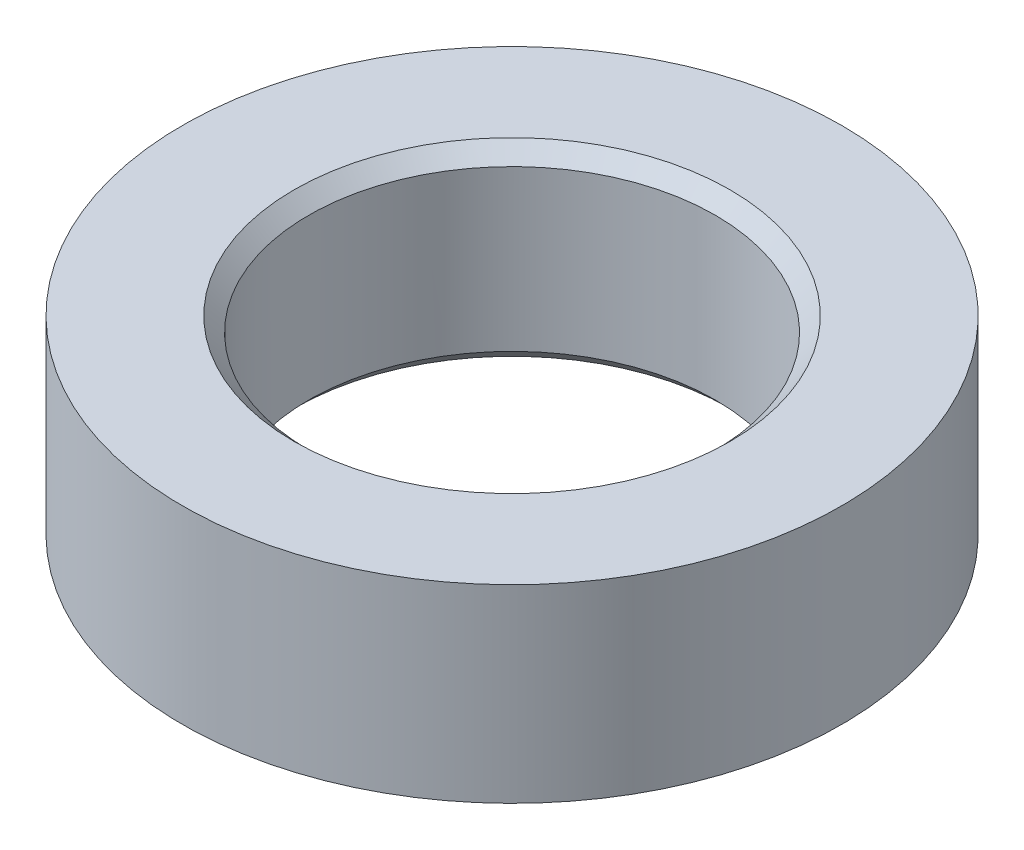
from build123d import *

# Parameters (mm, degrees)
SKETCH_1_R      = 11.225
SKETCH_1_R_2    = 6.925
EXTRUDE_1_DEPTH = 6.45
CHAMFER_1_SIZE  = 0.5


with BuildPart() as part:
    # 草图1 → 凸台-拉伸1 (new body)
    with BuildSketch(Plane(origin=(0, 0, 0), x_dir=(1, 0, 0), z_dir=(0, 1, 0))):
        with Locations(Location((0, 0, 0), (0, 0, 90))):
            Circle(SKETCH_1_R)
        with Locations(Location((0, 0, 0), (0, 0, 90))):
            Circle(SKETCH_1_R_2, mode=Mode.SUBTRACT)
    extrude(amount=EXTRUDE_1_DEPTH)

    # 倒角1
    chamfer_1_edges = [part.edges().sort_by_distance(p)[0] for p in [
        (0, 0, 6.925),
        (0, 6.45, 6.925),
    ]]
    chamfer(chamfer_1_edges, length=CHAMFER_1_SIZE)


solid = part.part
